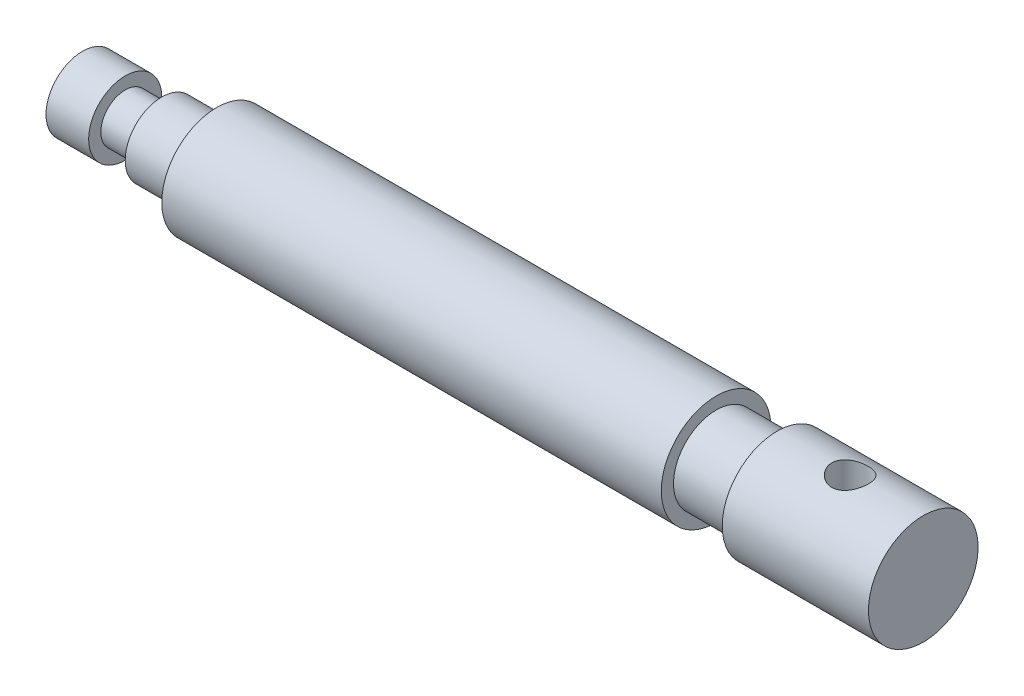
from build123d import *

# Parameters (mm, degrees)
CUT_EXTRUDE3_DEPTH      = 139.585713549
CUT_EXTRUDE3_DEPTH_BACK = 139.585713549
SKETCH3_R               = 3


with BuildPart() as part:
    # Sketch1 → Revolve1 (revolve)
    with BuildSketch(Plane(origin=(0, 0, 0), x_dir=(1, 0, 0), z_dir=(0, 1, 0)), mode=Mode.PRIVATE) as revolve1_sk:
        Polygon((0, 0), (0, 6), (7, 6), (7, 4), (13, 4), (13, 6), (22, 6), (22, 9), (104, 9), (104, 7), (114, 7), (114, 9), (138, 9), (138, 0), align=None)
    revolve(revolve1_sk.sketch.rotate(Axis((0, 0, 0), (1, 0, 0)), 180), axis=Axis((0, 0, 0), (1, 0, 0)))

    # Sketch3 → Cut-Extrude3 (cut, two sides: drawn at the far end of the back side and taken through both)
    with BuildSketch(Plane(origin=(0, 0, 0), x_dir=(1, 0, 0), z_dir=(0, 1, 0)).offset(-CUT_EXTRUDE3_DEPTH_BACK)):
        with Locations(Location((126, 0, 0), (0, 0, 90))):
            Circle(SKETCH3_R)
    extrude(amount=CUT_EXTRUDE3_DEPTH + CUT_EXTRUDE3_DEPTH_BACK, mode=Mode.SUBTRACT)


solid = part.part
